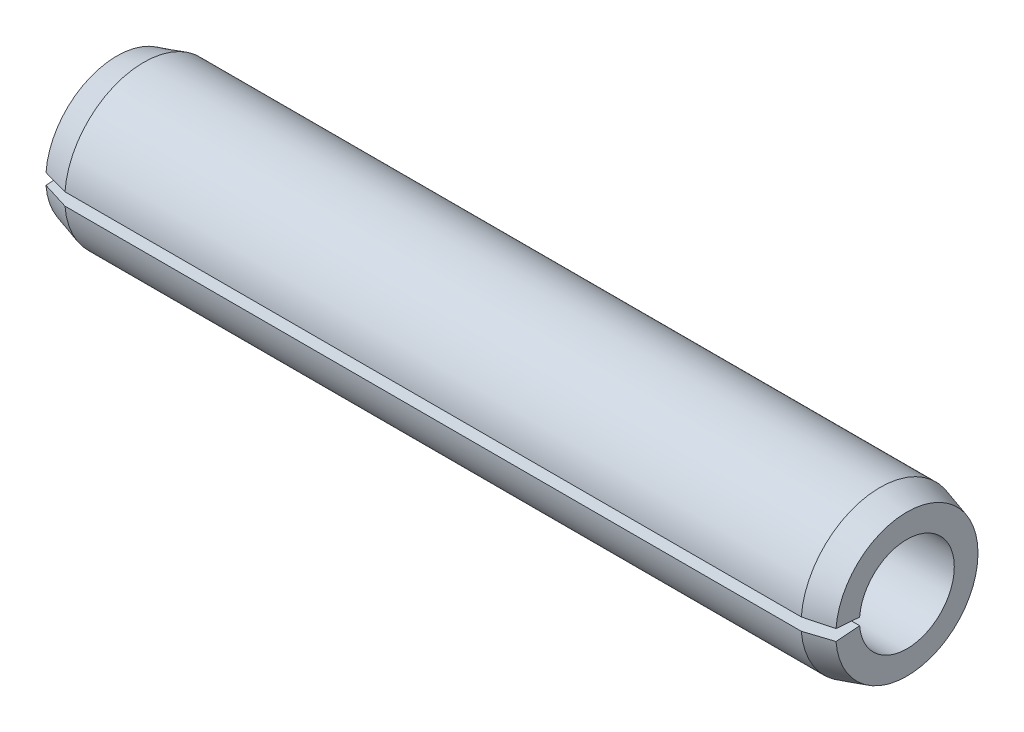
from build123d import *

# Parameters (mm, degrees)
GAP_DEPTH = 101.995049384


with BuildPart() as part:
    # BodySke → Body (revolve)
    with BuildSketch(Plane.XY, mode=Mode.PRIVATE) as body_sk:
        Polygon((0, 6), (100, 6), (100, 9), (96.6, 10), (3.4, 10), (0, 9), align=None)
    revolve(body_sk.sketch.rotate(Axis((-9.525, 0, 0), (1, 0, 0)), 90), axis=Axis((-9.525, 0, 0), (1, 0, 0)))

    # GapSke → Gap (cut, through all)
    with BuildSketch(Plane(origin=(0, 0, 0), x_dir=(0, -1, 0), z_dir=(-1, 0, 0))):
        with BuildLine():
            Line((0, 0), (0.800282776, 10.168556804))
            ThreePointArc((0.800282776, 10.168556804), (0, 10.2), (-0.800282776, 10.168556804))
            Line((-0.800282776, 10.168556804), (0, 0))
        make_face()
    extrude(amount=-GAP_DEPTH, mode=Mode.SUBTRACT)


solid = part.part
